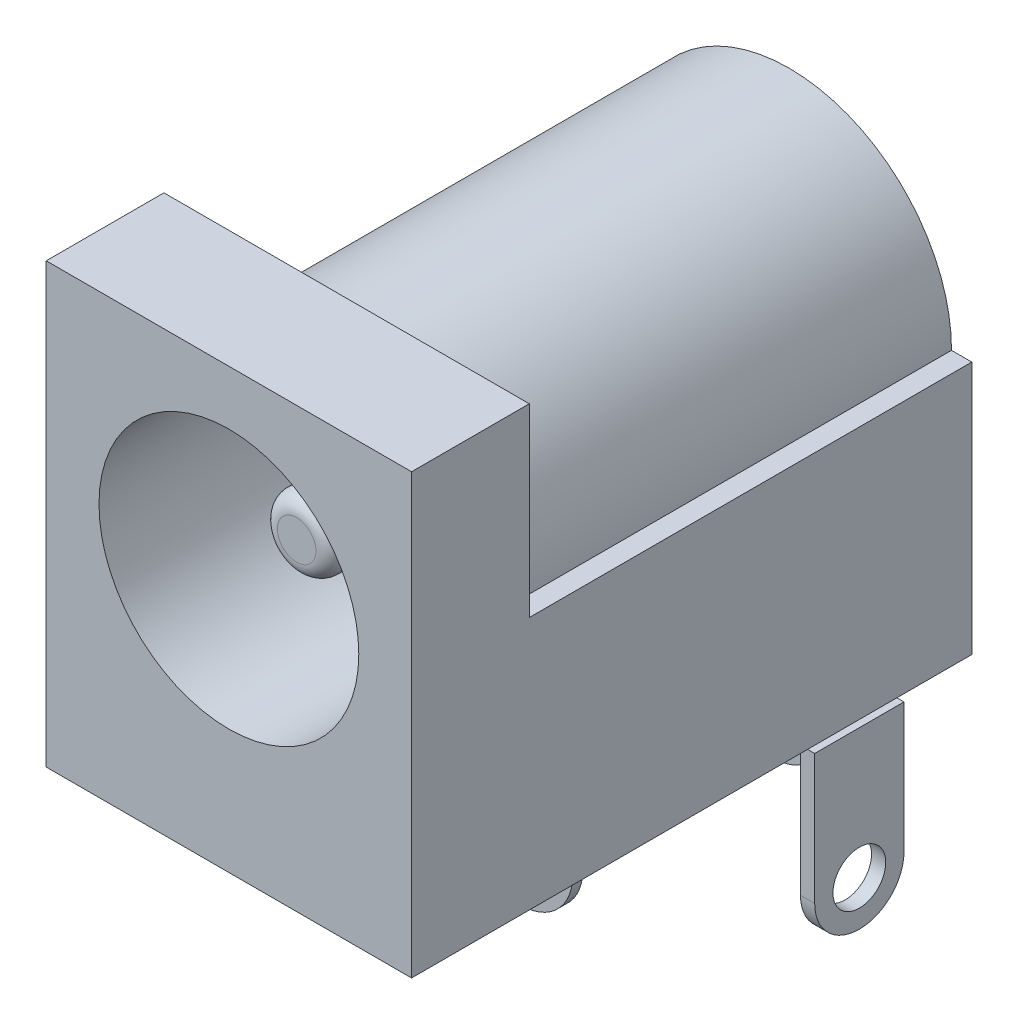
from build123d import *

# Parameters (mm, degrees)
SKETCH1_W           = 9
SKETCH1_H           = 10.8
BOSS_EXTRUDE1_DEPTH = 2.9
BOSS_EXTRUDE2_DEPTH = 10.9
SKETCH3_R           = 3.2
CUT_EXTRUDE1_DEPTH  = 9.54
SKETCH4_R           = 0.875
BOSS_EXTRUDE3_DEPTH = 7.87
FILLET1_R           = 0.4
SKETCH5_W           = 2.54
SKETCH5_H           = 0.25
SKETCH5_W_2         = 2.3
SKETCH5_H_2         = 0.35
SKETCH5_W_3         = 0.35
SKETCH5_H_3         = 2.2
BOSS_EXTRUDE4_DEPTH = 4.3
CUT_EXTRUDE2_START  = -0.25
SKETCH6_R           = 0.65
CUT_EXTRUDE2_DEPTH  = 0.25
SKETCH7_R           = 0.65
CUT_EXTRUDE3_DEPTH  = 18.881265336
CUT_EXTRUDE5_START  = -0.35
SKETCH9_R           = 0.65
CUT_EXTRUDE5_DEPTH  = 0.35


with BuildPart() as part:
    # Sketch1 → Boss-Extrude1 (new body)
    with BuildSketch(Plane.XY):
        with Locations((4.5, 5.4)):
            Rectangle(SKETCH1_W, SKETCH1_H)
    extrude(amount=BOSS_EXTRUDE1_DEPTH)

    # Sketch2 → Boss-Extrude2 (add)
    with BuildSketch(Plane(origin=(0, 0, 0), x_dir=(-1, 0, 0), z_dir=(0, 0, -1))):
        with BuildLine():
            Line((-9, 0), (0, 0))
            Line((0, 0), (0, 6.24))
            Line((0, 6.24), (-0.50005, 6.24))
            ThreePointArc((-0.50005, 6.24), (-4.5, 10.26), (-8.49995, 6.24))
            Line((-8.49995, 6.24), (-9, 6.24))
            Line((-9, 6.24), (-9, 0))
        make_face()
    extrude(amount=BOSS_EXTRUDE2_DEPTH)

    # Sketch3 → Cut-Extrude1 (cut)
    with BuildSketch(Plane.XY.offset(2.9)):
        with Locations((4.5, 6.26)):
            Circle(SKETCH3_R)
    extrude(amount=-CUT_EXTRUDE1_DEPTH, mode=Mode.SUBTRACT)

    # Sketch4 → Boss-Extrude3 (add)
    with BuildSketch(Plane.XY.offset(-6.64)):
        with Locations(Location((4.5, 6.26, 0), (0, 0, 180))):
            Circle(SKETCH4_R)
    extrude(amount=BOSS_EXTRUDE3_DEPTH)

    # Fillet1
    fillet1_edges = [part.edges().sort_by_distance(p)[0] for p in [
        (5.375, 6.26, 1.23),
    ]]
    fillet(fillet1_edges, radius=FILLET1_R)

    # Sketch5 → Boss-Extrude4 (add)
    with BuildSketch(Plane.XZ):
        with Locations((4.5, -4.425)):
            Rectangle(SKETCH5_W, SKETCH5_H)
        with Locations((4.5, -10.73)):
            Rectangle(SKETCH5_W_2, SKETCH5_H_2)
        with Locations((9, -7.955)):
            Rectangle(SKETCH5_W_3, SKETCH5_H_3)
    extrude(amount=BOSS_EXTRUDE4_DEPTH)

    # Sketch6 → Cut-Extrude2 (cut)
    with BuildSketch(Plane.XY.offset(-4.3).offset(CUT_EXTRUDE2_START)):
        with Locations((4.5, -3.03)):
            Circle(SKETCH6_R)
        with BuildLine():
            Line((3.23, -3.03), (2.98145415, -3.03))
            Line((2.98145415, -3.03), (2.98145415, -4.481636856))
            Line((2.98145415, -4.481636856), (5.931605951, -4.481636856))
            Line((5.931605951, -4.481636856), (5.931605951, -3.03))
            Line((5.931605951, -3.03), (5.77, -3.03))
            ThreePointArc((5.77, -3.03), (4.5, -4.3), (3.23, -3.03))
        make_face()
    extrude(amount=CUT_EXTRUDE2_DEPTH, mode=Mode.SUBTRACT)

    # Sketch7 → Cut-Extrude3 (cut, through all)
    with BuildSketch(Plane(origin=(9.175, 0, 0), x_dir=(0, 0, -1), z_dir=(1, 0, 0))):
        with Locations((7.955, -3.2)):
            Circle(SKETCH7_R)
        with BuildLine():
            Line((6.855, -3.2), (6.537099377, -3.2))
            Line((6.537099377, -3.2), (6.537099377, -4.556833282))
            Line((6.537099377, -4.556833282), (9.415825045, -4.556833282))
            Line((9.415825045, -4.556833282), (9.415825045, -3.2))
            Line((9.415825045, -3.2), (9.055, -3.2))
            ThreePointArc((9.055, -3.2), (7.955, -4.3), (6.855, -3.2))
        make_face()
    extrude(amount=-CUT_EXTRUDE3_DEPTH, mode=Mode.SUBTRACT)

    # Sketch9 → Cut-Extrude5 (cut)
    with BuildSketch(Plane(origin=(0, 0, -10.905), x_dir=(-1, 0, 0), z_dir=(0, 0, -1)).offset(CUT_EXTRUDE5_START)):
        with Locations((-4.5, -3.15)):
            Circle(SKETCH9_R)
        with BuildLine():
            Line((-5.65, -3.15), (-6.063372646, -3.15))
            Line((-6.063372646, -3.15), (-6.063372646, -4.563001678))
            Line((-6.063372646, -4.563001678), (-3.002045836, -4.563001678))
            Line((-3.002045836, -4.563001678), (-3.002045836, -3.15))
            Line((-3.002045836, -3.15), (-3.35, -3.15))
            ThreePointArc((-3.35, -3.15), (-4.5, -4.3), (-5.65, -3.15))
        make_face()
    extrude(amount=CUT_EXTRUDE5_DEPTH, mode=Mode.SUBTRACT)


solid = part.part
